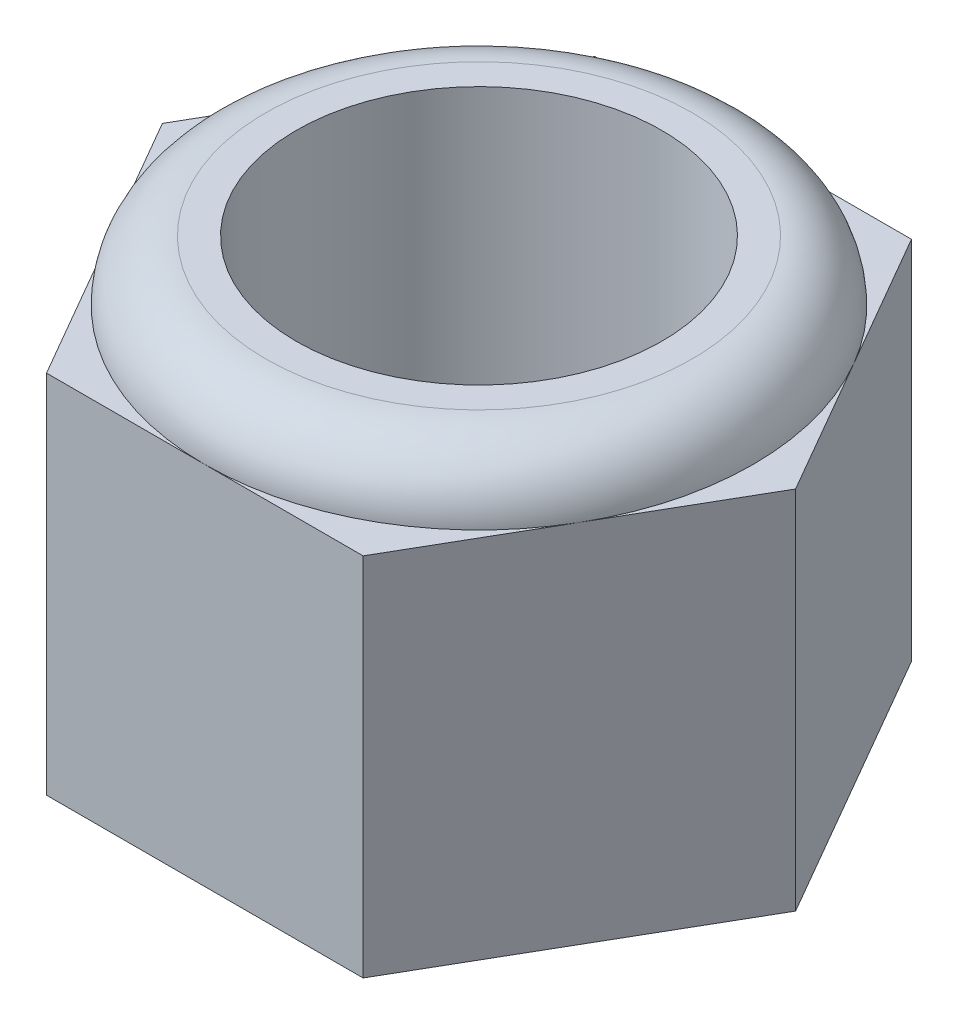
from build123d import *

# Parameters (mm, degrees)
BOSS_EXTRU_1_DEPTH      = 22.225
ESQUISSE2_R             = 9.525
ENL_V_MAT_EXTRU_1_DEPTH = 32.148999282


with BuildPart() as part:
    # Esquisse1 → Boss.-Extru.1 (new body)
    with BuildSketch(Plane(origin=(0, 0, 0), x_dir=(1, 0, 0), z_dir=(0, 1, 0))):
        Polygon((8.248891971, 14.2875), (-8.248891971, 14.2875), (-16.497783942, 0), (-8.248891971, -14.2875), (8.248891971, -14.2875), (16.497783942, 0), align=None)
    extrude(amount=BOSS_EXTRU_1_DEPTH)

    # Esquisse2 → Enlèv. mat.-Extru.1 (cut, through all)
    with BuildSketch(Plane(origin=(0, 22.225, 0), x_dir=(1, 0, 0), z_dir=(0, 1, 0))):
        with Locations(Location((0, 0, 0), (0, 0, 270))):
            Circle(ESQUISSE2_R)
    extrude(amount=-ENL_V_MAT_EXTRU_1_DEPTH, mode=Mode.SUBTRACT)

    # Esquisse3 → Enlèvement de matière-Révolution1 (revolve, cut)
    with BuildSketch(Plane(origin=(0, 0, 0), x_dir=(0, 0, -1), z_dir=(1, 0, 0)), mode=Mode.PRIVATE) as enl_vement_de_mati_re_r_volution1_sk:
        with BuildLine():
            Line((-14.2875, 22.225), (-12.7, 22.225))
            Line((-12.7, 22.225), (-11.1125, 22.225))
            ThreePointArc((-11.1125, 22.225), (-13.35756403, 21.29506403), (-14.2875, 19.05))
            Line((-14.2875, 19.05), (-17.4625, 19.05))
            Line((-17.4625, 19.05), (-17.4625, 22.225))
            Line((-17.4625, 22.225), (-14.2875, 22.225))
        make_face()
    revolve(enl_vement_de_mati_re_r_volution1_sk.sketch.rotate(Axis((0, 0, 0), (0, 1, 0)), 180), axis=Axis((0, 0, 0), (0, 1, 0)), mode=Mode.SUBTRACT)


solid = part.part
